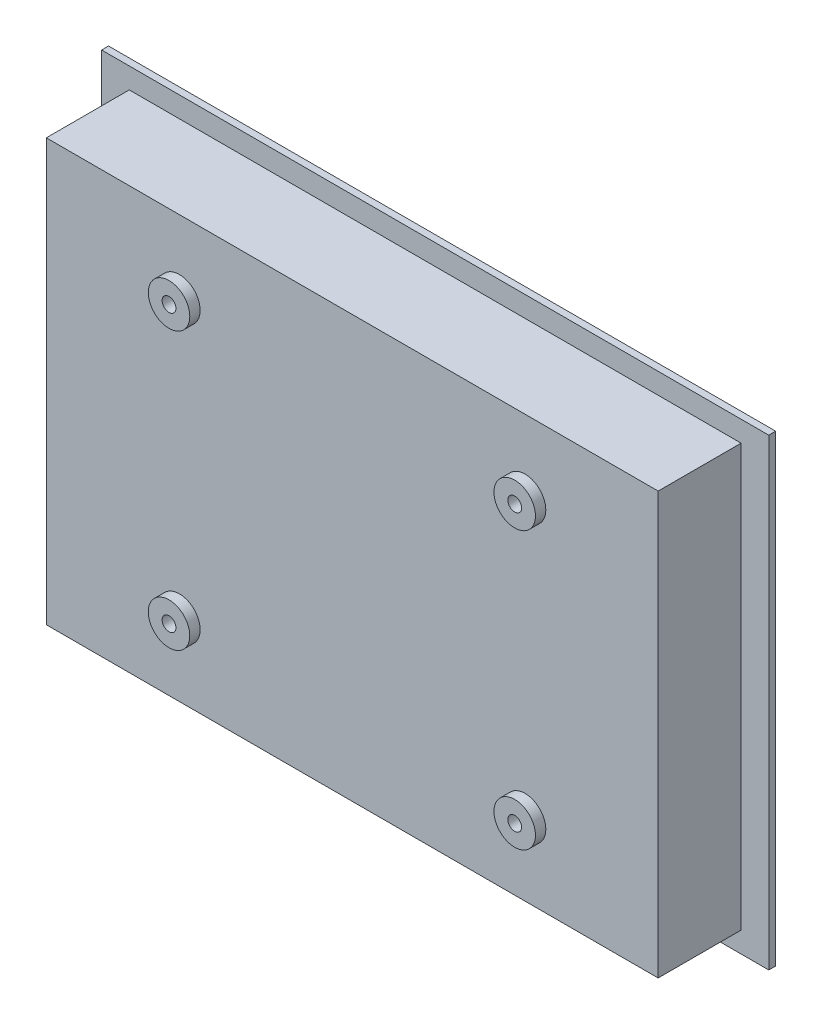
from build123d import *

# Parameters (mm, degrees)
SKETCH_1_W               = 193
SKETCH_1_H               = 134
EXTRUDE_1_DEPTH          = 2
SKETCH_2_W               = 177
SKETCH_2_H               = 122
EXTRUDE_2_DEPTH          = 24
CUT_EXTRUDE_1_DEPTH      = 10
CUT_EXTRUDE_1_DEPTH_BACK = 5
SKETCH_3_R               = 2
EXTRUDE_START            = 3
SKETCH_4_R               = 6
SKETCH_4_R_2             = 2
EXTRUDE_3_DEPTH          = 3


with BuildPart() as part:
    # 草图1 → 凸台-拉伸1 (new body)
    with BuildSketch(Plane.XY):
        Rectangle(SKETCH_1_W, SKETCH_1_H)
    extrude(amount=EXTRUDE_1_DEPTH)

    # 草图2 → 凸台-拉伸2 (add)
    with BuildSketch(Plane.XY.offset(2)):
        Rectangle(SKETCH_2_W, SKETCH_2_H)
    extrude(amount=EXTRUDE_2_DEPTH)

    # 草图3 → 切除-拉伸1 (cut, two sides: drawn at the far end of the back side and taken through both)
    with BuildSketch(Plane.XY.offset(26).offset(-CUT_EXTRUDE_1_DEPTH_BACK)):
        with Locations((-50, 40)):
            Circle(SKETCH_3_R)
        with Locations((-50, -40)):
            Circle(SKETCH_3_R)
        with Locations((50, -40)):
            Circle(SKETCH_3_R)
        with Locations((50, 40)):
            Circle(SKETCH_3_R)
    extrude(amount=CUT_EXTRUDE_1_DEPTH + CUT_EXTRUDE_1_DEPTH_BACK, mode=Mode.SUBTRACT)

    # 草图4 → 凸台-拉伸3 (add)
    # profile 1 of 4: a face of its own
    with BuildSketch(Plane.XY.offset(26).offset(EXTRUDE_START)):
        with Locations((-50, 40)):
            Circle(SKETCH_4_R)
        with Locations((-50, 40)):
            Circle(SKETCH_4_R_2, mode=Mode.SUBTRACT)
    # profile 2 of 4: a face of its own
    with BuildSketch(Plane.XY.offset(26).offset(EXTRUDE_START)):
        with Locations((-50, -40)):
            Circle(SKETCH_4_R)
        with Locations((-50, -40)):
            Circle(SKETCH_4_R_2, mode=Mode.SUBTRACT)
    # profile 3 of 4: a face of its own
    with BuildSketch(Plane.XY.offset(26).offset(EXTRUDE_START)):
        with Locations((50, -40)):
            Circle(SKETCH_4_R)
        with Locations((50, -40)):
            Circle(SKETCH_4_R_2, mode=Mode.SUBTRACT)
    # profile 4 of 4: a face of its own
    with BuildSketch(Plane.XY.offset(26).offset(EXTRUDE_START)):
        with Locations((50, 40)):
            Circle(SKETCH_4_R)
        with Locations((50, 40)):
            Circle(SKETCH_4_R_2, mode=Mode.SUBTRACT)
    extrude(amount=-EXTRUDE_3_DEPTH)


solid = part.part
